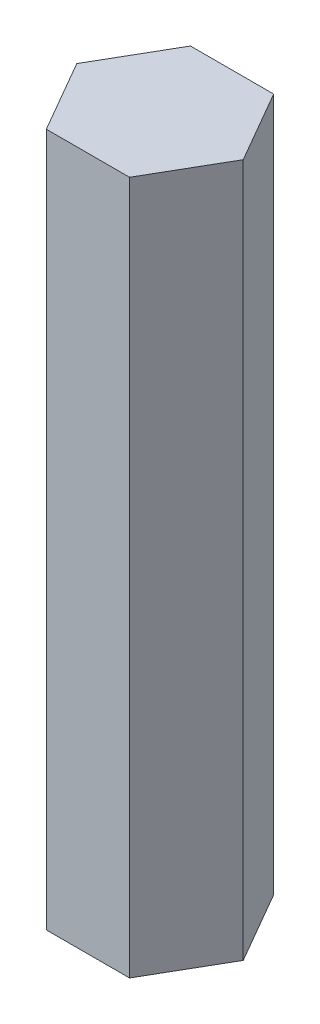
from build123d import *

# Parameters (mm, degrees)
BOSS_EXTRUDE1_DEPTH = 25
SKETCH3_R           = 1.6
CUT_EXTRUDE1_DEPTH  = 5


with BuildPart() as part:
    # Sketch1 → Boss-Extrude1 (new body)
    with BuildSketch(Plane(origin=(0, 0, 0), x_dir=(1, 0, 0), z_dir=(0, 1, 0))):
        Polygon((3, 0), (1.5, 2.598076211), (-1.5, 2.598076211), (-3, 0), (-1.5, -2.598076211), (1.5, -2.598076211), align=None)
    extrude(amount=BOSS_EXTRUDE1_DEPTH)

    # Sketch3 → Cut-Extrude1 (cut)
    with BuildSketch(Plane.XZ):
        with Locations(Location((0, 0, 0), (0, 0, 270))):
            Circle(SKETCH3_R)
    extrude(amount=-CUT_EXTRUDE1_DEPTH, mode=Mode.SUBTRACT)


solid = part.part
